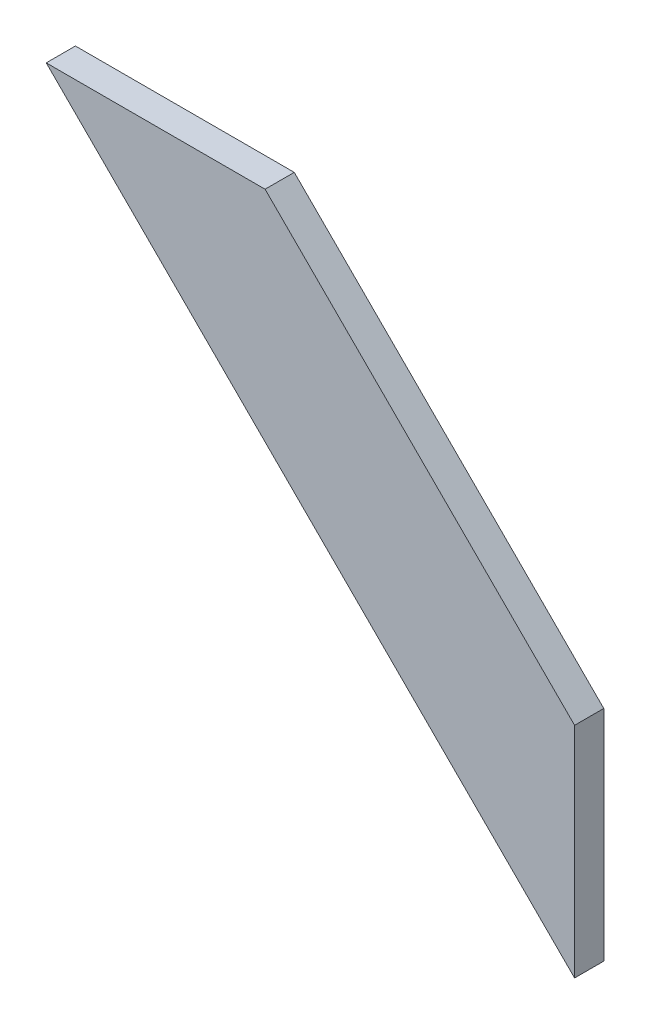
from build123d import *

# Parameters (mm, degrees)
BOSS_EXTRUDE1_DEPTH = 2


with BuildPart() as part:
    # Sketch1 → Boss-Extrude1 (new body)
    with BuildSketch(Plane.XY):
        Polygon((0, 0), (15, 0), (36.213203436, -21.213203436), (36.213203436, -36.213203436), align=None)
    extrude(amount=BOSS_EXTRUDE1_DEPTH)


solid = part.part
